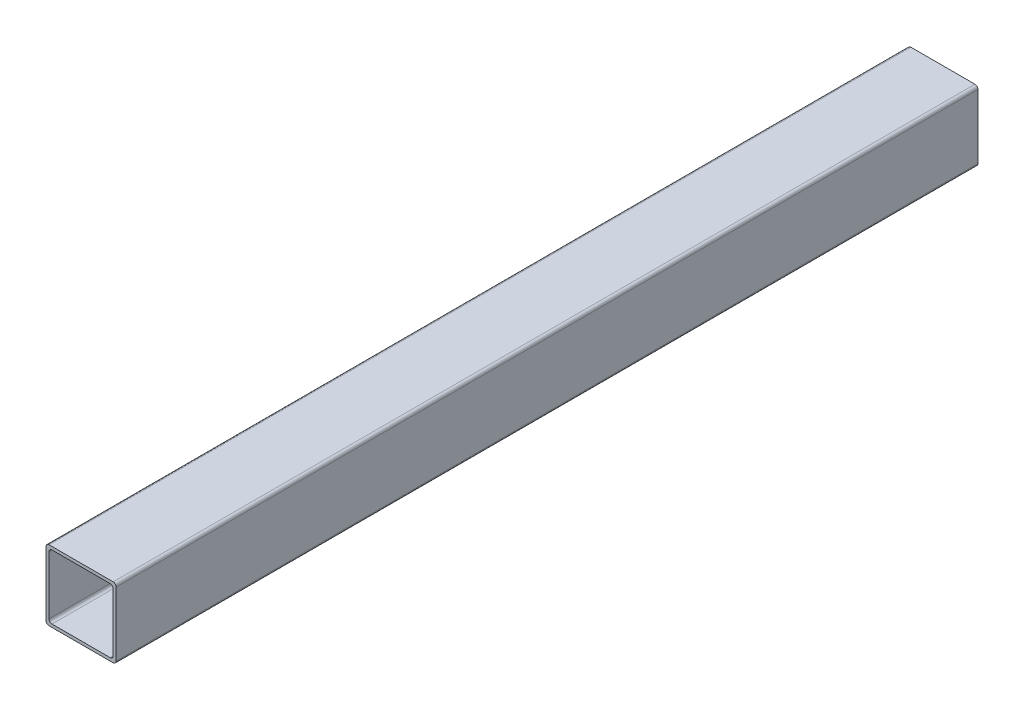
from build123d import *

# Parameters (mm, degrees)
SKETCH1_W           = 70
SKETCH1_H           = 70
SKETCH1_W_2         = 64
SKETCH1_H_2         = 64
BOSS_EXTRUDE1_DEPTH = 860
FILLET1_R           = 3


with BuildPart() as part:
    # Sketch1 → Boss-Extrude1 (new body)
    with BuildSketch(Plane.XY):
        with Locations((35, 35)):
            Rectangle(SKETCH1_W, SKETCH1_H)
        with Locations((35, 35)):
            Rectangle(SKETCH1_W_2, SKETCH1_H_2, mode=Mode.SUBTRACT)
    extrude(amount=BOSS_EXTRUDE1_DEPTH)

    # Fillet1
    fillet1_edges = [part.edges().sort_by_distance(p)[0] for p in [
        (3, 67, 430),
        (3, 3, 430),
        (67, 3, 430),
        (67, 67, 430),
        (0, 70, 430),
        (70, 70, 430),
        (70, 0, 430),
        (0, 0, 430),
    ]]
    fillet(fillet1_edges, radius=FILLET1_R)


solid = part.part
